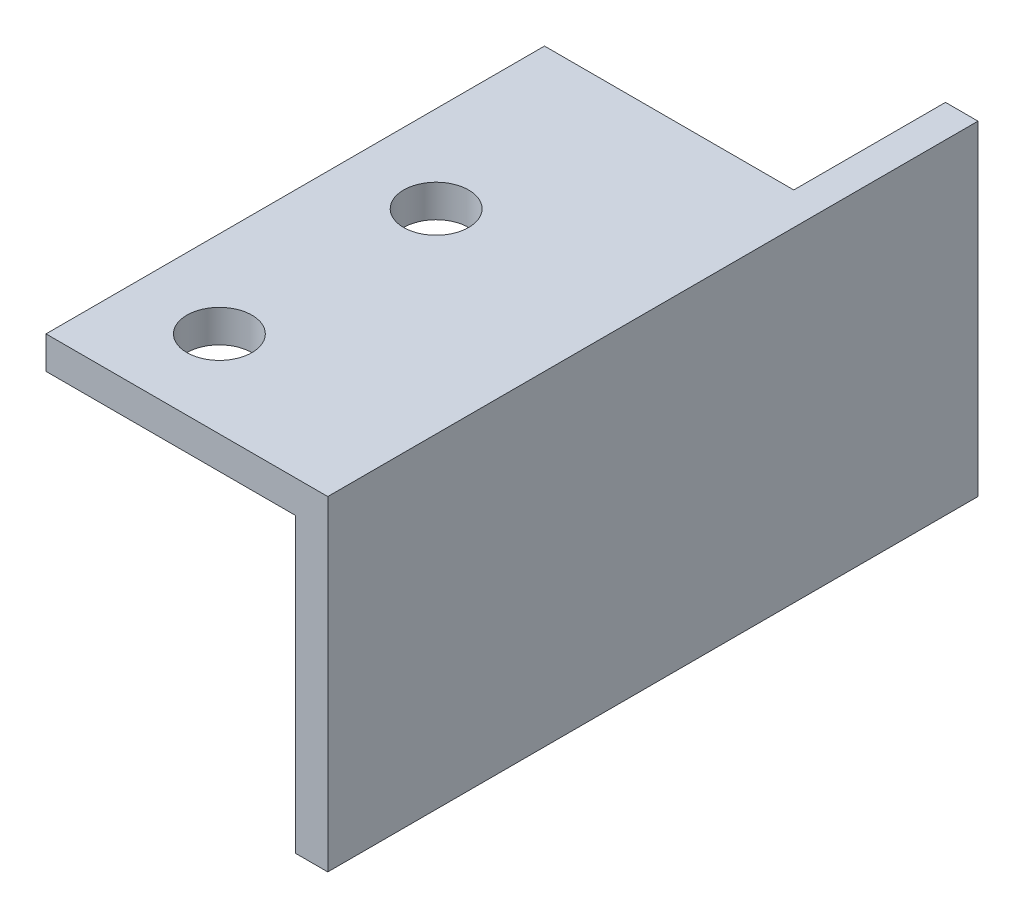
from build123d import *

# Parameters (mm, degrees)
EXTRUSION1_DEPTH = 30
ESQUISSE2_R      = 1.5
ESQUISSE2_W      = 11.5
ESQUISSE2_H      = 7
EXTRUSION2_DEPTH = 30


with BuildPart() as part:
    # Esquisse1 → Extrusion1 (new body)
    with BuildSketch(Plane.XY):
        Polygon((-276.465646311, 896.941960338), (-276.465646311, 911.941960338), (-289.465646311, 911.941960338), (-289.465646311, 910.441960338), (-277.965646311, 910.441960338), (-277.965646311, 896.941960338), align=None)
    extrude(amount=EXTRUSION1_DEPTH)

    # Esquisse2 → Extrusion2 (cut)
    with BuildSketch(Plane(origin=(0, 911.941960338, 0), x_dir=(-1, 0, 0), z_dir=(0, 1, 0))):
        with Locations(Location((285.465646311, 16, 0), (0, 0, 90))):
            Circle(ESQUISSE2_R)
        with Locations(Location((285.465646311, 26, 0), (0, 0, 90))):
            Circle(ESQUISSE2_R)
        with Locations((283.715646311, 3.5)):
            Rectangle(ESQUISSE2_W, ESQUISSE2_H)
    extrude(amount=-EXTRUSION2_DEPTH, mode=Mode.SUBTRACT)


solid = part.part
